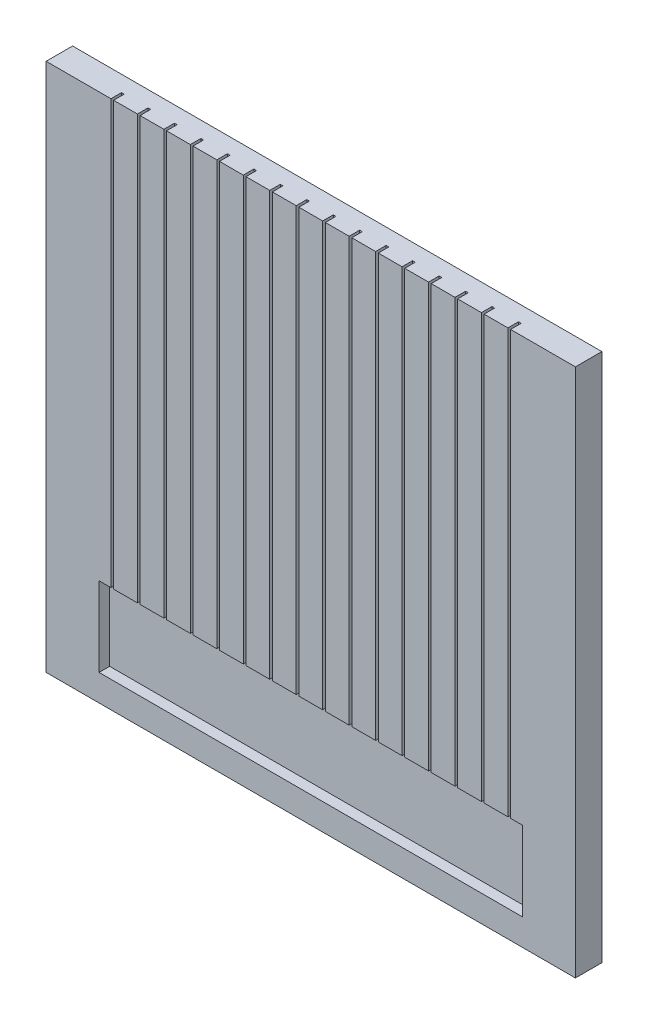
from build123d import *

# Parameters (mm, degrees)
SKETCH1_W           = 10
SKETCH1_H           = 10
BOSS_EXTRUDE1_DEPTH = 0.5
SKETCH2_W           = 8
SKETCH2_H           = 1.5
CUT_EXTRUDE1_DEPTH  = 0.2
SKETCH3_W           = 0.05
SKETCH3_H           = 8
CUT_EXTRUDE2_DEPTH  = 0.2


with BuildPart() as part:
    # Sketch1 → Boss-Extrude1 (new body)
    with BuildSketch(Plane(origin=(0, 0, 0), x_dir=(0, 1, 0), z_dir=(0, 0, 1))):
        with Locations((5, -5)):
            Rectangle(SKETCH1_W, SKETCH1_H)
    extrude(amount=BOSS_EXTRUDE1_DEPTH)

    # Sketch2 → Cut-Extrude1 (cut)
    with BuildSketch(Plane.XY.offset(0.5)):
        with Locations((5, 1.25)):
            Rectangle(SKETCH2_W, SKETCH2_H)
    extrude(amount=-CUT_EXTRUDE1_DEPTH, mode=Mode.SUBTRACT)

    # Sketch3 → Cut-Extrude2 (cut)
    with BuildSketch(Plane.XY.offset(0.5)):
        with Locations((1.25, 6)):
            Rectangle(SKETCH3_W, SKETCH3_H)
        with Locations((1.75, 6)):
            Rectangle(SKETCH3_W, SKETCH3_H)
        with Locations((2.25, 6)):
            Rectangle(SKETCH3_W, SKETCH3_H)
        with Locations((2.75, 6)):
            Rectangle(SKETCH3_W, SKETCH3_H)
        with Locations((3.25, 6)):
            Rectangle(SKETCH3_W, SKETCH3_H)
        with Locations((3.75, 6)):
            Rectangle(SKETCH3_W, SKETCH3_H)
        with Locations((4.25, 6)):
            Rectangle(SKETCH3_W, SKETCH3_H)
        with Locations((4.75, 6)):
            Rectangle(SKETCH3_W, SKETCH3_H)
        with Locations((5.25, 6)):
            Rectangle(SKETCH3_W, SKETCH3_H)
        with Locations((5.75, 6)):
            Rectangle(SKETCH3_W, SKETCH3_H)
        with Locations((6.25, 6)):
            Rectangle(SKETCH3_W, SKETCH3_H)
        with Locations((6.75, 6)):
            Rectangle(SKETCH3_W, SKETCH3_H)
        with Locations((7.25, 6)):
            Rectangle(SKETCH3_W, SKETCH3_H)
        with Locations((7.75, 6)):
            Rectangle(SKETCH3_W, SKETCH3_H)
        with Locations((8.25, 6)):
            Rectangle(SKETCH3_W, SKETCH3_H)
        with Locations((8.75, 6)):
            Rectangle(SKETCH3_W, SKETCH3_H)
    extrude(amount=-CUT_EXTRUDE2_DEPTH, mode=Mode.SUBTRACT)


solid = part.part
